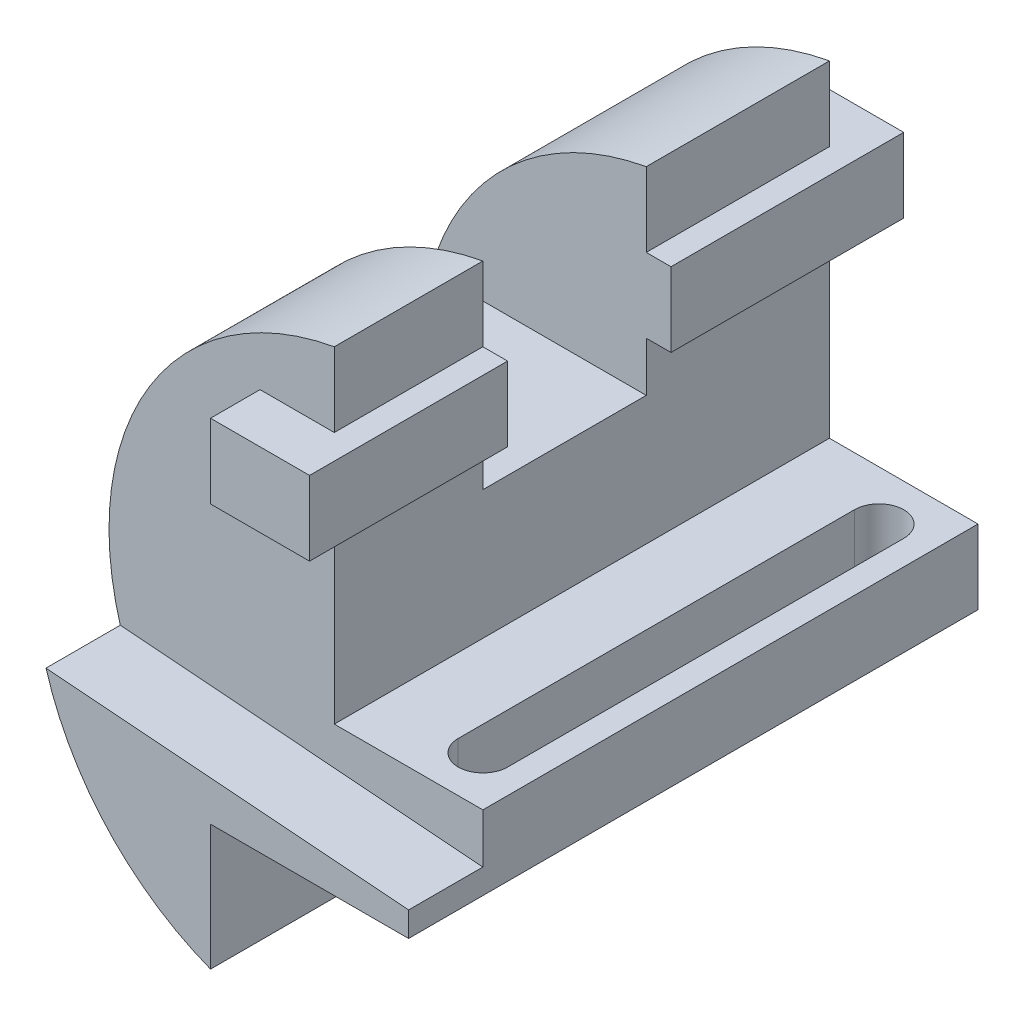
from build123d import *

# Parameters (mm, degrees)
BOSS_EXTRUDE1_DEPTH      = 115
CUT_EXTRUDE1_START       = -15
CUT_EXTRUDE1_DEPTH       = 15
BOSS_EXTRUDE2_DEPTH      = 10
BOSS_EXTRUDE2_DEPTH_BACK = 110
SKETCH3_W                = 20
SKETCH3_H                = 15
CUT_EXTRUDE2_DEPTH       = 148.83859442
CUT_EXTRUDE2_DEPTH_BACK  = 148.83859442
SKETCH4_W                = 33
SKETCH4_H                = 40
CUT_EXTRUDE3_DEPTH       = 153.581945197
CUT_EXTRUDE3_DEPTH_BACK  = 153.581945197


with BuildPart() as part:
    # Sketch1 → Boss-Extrude1 (new body)
    with BuildSketch(Plane.XY):
        with BuildLine():
            Line((0, 0), (-40, 0))
            Line((-40, 0), (-40, -25.362796982))
            ThreePointArc((-40, -25.362796982), (-75.256322222, 31.603413808), (-30, 81))
            Line((-30, 81), (-30, 15))
            Line((-30, 15), (0, 15))
            Line((0, 15), (0, 0))
        make_face()
    extrude(amount=BOSS_EXTRUDE1_DEPTH)

    # Sketch2 → Cut-Extrude1 (cut)
    with BuildSketch(Plane.XY.offset(115).offset(CUT_EXTRUDE1_START)):
        with BuildLine():
            Line((0, 5), (-73.226382592, 10.685668923))
            ThreePointArc((-73.226382592, 10.685668923), (-67.28023004, 55.474290815), (-30, 81))
            Line((-30, 81), (-30, 15))
            Line((-30, 15), (0, 15))
            Line((0, 15), (0, 5))
        make_face()
    extrude(amount=CUT_EXTRUDE1_DEPTH, mode=Mode.SUBTRACT)

    # Sketch3 → Boss-Extrude2 (add, two sides: drawn at the far end of the back side and taken through both)
    with BuildSketch(Plane(origin=(0, 0, 0), x_dir=(-1, 0, 0), z_dir=(0, 0, -1)).offset(-BOSS_EXTRUDE2_DEPTH_BACK)):
        with Locations((35, 58.5)):
            Rectangle(SKETCH3_W, SKETCH3_H)
    extrude(amount=BOSS_EXTRUDE2_DEPTH + BOSS_EXTRUDE2_DEPTH_BACK)

    # Sketch4 → Cut-Extrude2 (cut, two sides: drawn at the far end of the back side and taken through both)
    with BuildSketch(Plane(origin=(-30, 0, 0), x_dir=(0, 0, -1), z_dir=(1, 0, 0)).offset(-CUT_EXTRUDE2_DEPTH_BACK)):
        with Locations((-53.5, 61)):
            Rectangle(SKETCH4_W, SKETCH4_H)
    extrude(amount=CUT_EXTRUDE2_DEPTH + CUT_EXTRUDE2_DEPTH_BACK, mode=Mode.SUBTRACT)

    # Sketch5 → Cut-Extrude3 (cut, two sides: drawn at the far end of the back side and taken through both)
    with BuildSketch(Plane(origin=(0, 15, 0), x_dir=(1, 0, 0), z_dir=(0, 1, 0)).offset(-CUT_EXTRUDE3_DEPTH_BACK)):
        with BuildLine():
            Line((-4.98034548, -10), (-4.98034548, -90))
            ThreePointArc((-4.98034548, -90), (-9.98034548, -95), (-14.98034548, -90))
            Line((-14.98034548, -90), (-14.98034548, -10))
            ThreePointArc((-14.98034548, -10), (-9.98034548, -5), (-4.98034548, -10))
        make_face()
    extrude(amount=CUT_EXTRUDE3_DEPTH + CUT_EXTRUDE3_DEPTH_BACK, mode=Mode.SUBTRACT)


solid = part.part
